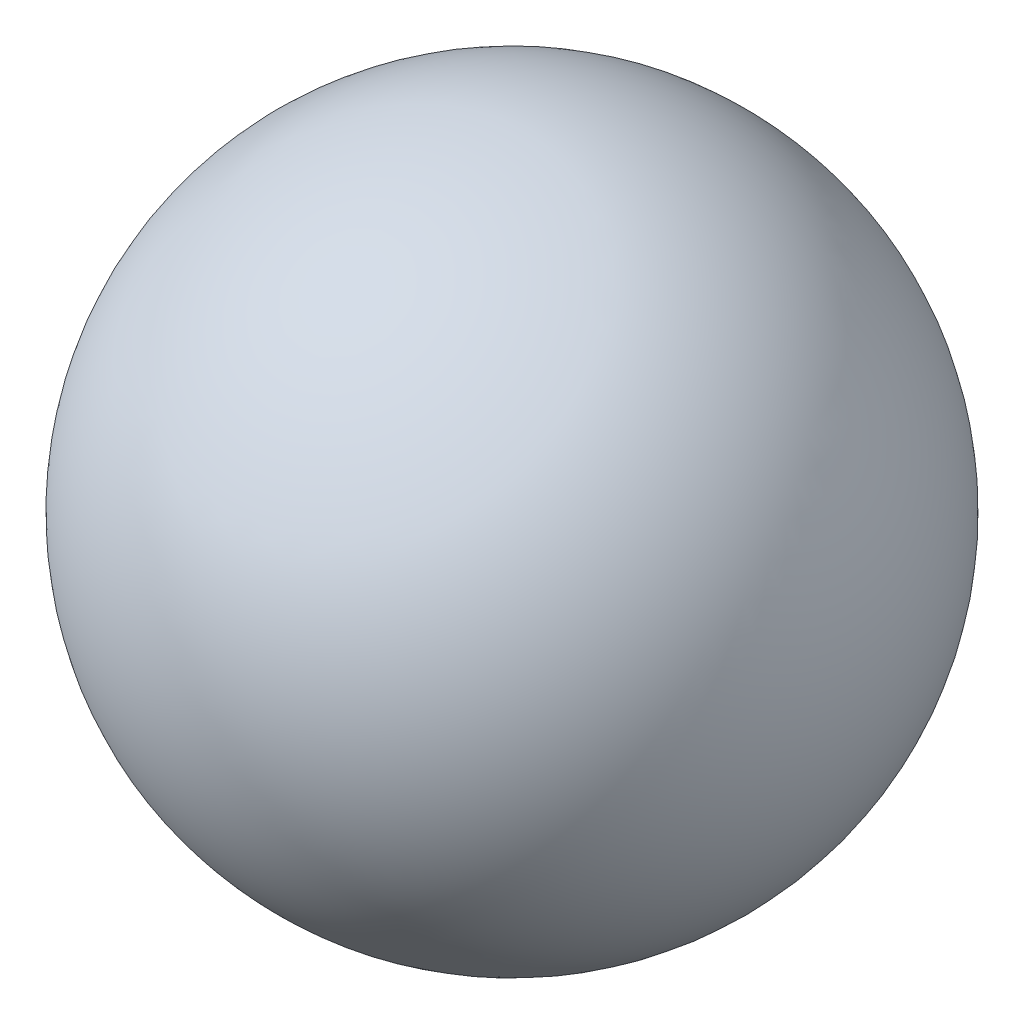
from build123d import *


with BuildPart() as part:
    # Sketch1 → Revolve1 (revolve)
    with BuildSketch(Plane(origin=(0, 0, 0), x_dir=(-1, 0, 0), z_dir=(0, 0, -1))):
        with BuildLine():
            Line((-1.604994878, 2.779932675), (-2.363755122, 4.094143968))
            ThreePointArc((-2.363755122, 4.094143968), (-2.641480646, 3.0576582), (-1.604994878, 2.779932675))
        make_face()
    revolve(axis=Axis((1.560977146, 2.703691727, 0), (0.5000000000000009, 0.8660254037844382, 0)))


solid = part.part
